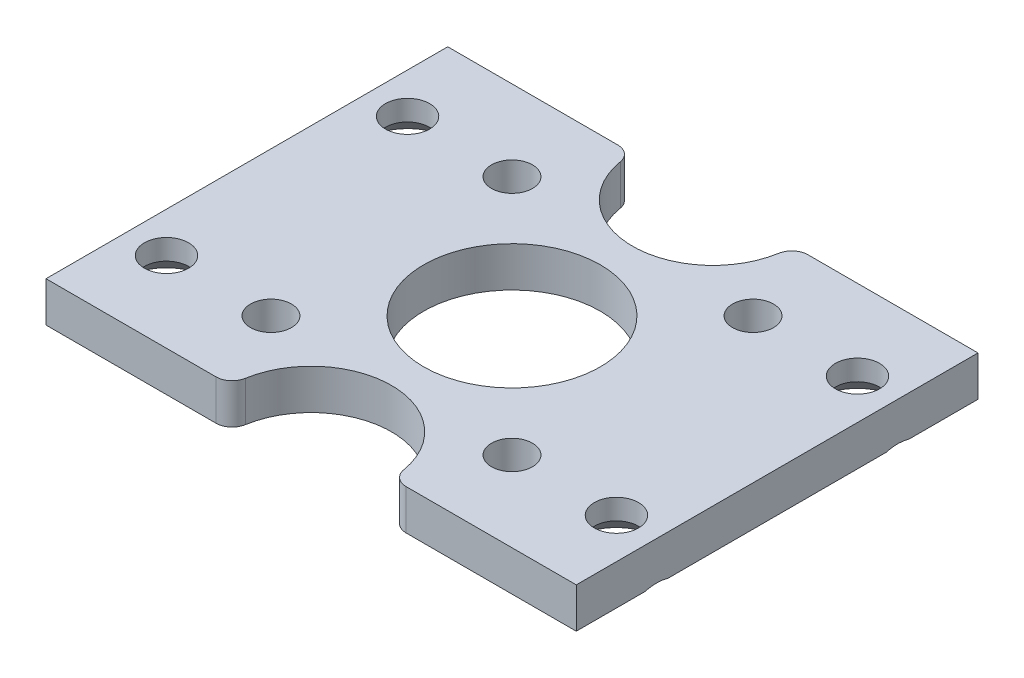
from build123d import *

# Parameters (mm, degrees)
SKETCH_1_W                  = 66
SKETCH_1_H                  = 50
EXTRUDE_1_DEPTH             = 5
HOLE_WIZARD_20_0_20_1_D     = 20
HOLE_WIZARD_22_0_22_1_D     = 22
HOLE_WIZARD_5_1_5_1_1_D     = 5.1
HOLE_WIZARD_M5_1_AT_2_COUNT = 2
HOLE_WIZARD_M5_1_AT_2_PITCH = 30
HOLE_WIZARD_M5_1_AT_3_COUNT = 2
HOLE_WIZARD_M5_1_AT_3_PITCH = 63.529520697
HOLE_WIZARD_M5_1_AT_4_COUNT = 2
HOLE_WIZARD_M5_1_AT_4_PITCH = 56
FILLET_1_R                  = 2


with BuildPart() as part:
    # 草图1 → 凸台-拉伸1 (new body)
    with BuildSketch(Plane.XZ):
        with Locations((33, -25)):
            Rectangle(SKETCH_1_W, SKETCH_1_H)
    extrude(amount=-EXTRUDE_1_DEPTH)

    # Ø20.0 (20) 直径孔1 (through all)
    with Locations(Plane(origin=(0, 5, 0), x_dir=(1, 0, 0), z_dir=(0, 1, 0))):
        with Locations((33, 0), (33, 50)):
            Hole(HOLE_WIZARD_20_0_20_1_D / 2)

    # Ø22.0 (22) 直径孔1 (through all)
    with Locations(Plane(origin=(0, 0, 0), x_dir=(-1, 0, 0), z_dir=(0, -1, 0))):
        with Locations((-33, 25)):
            Hole(HOLE_WIZARD_22_0_22_1_D / 2)

    # Ø5.1 (5.1) 直径孔1 (through all)
    with Locations(Plane(origin=(0, 0, 0), x_dir=(-1, 0, 0), z_dir=(0, -1, 0))):
        with Locations((-18, 10), (-48, 40), (-48, 10), (-18, 40)):
            Hole(HOLE_WIZARD_5_1_5_1_1_D / 2)

    # 草图8 → M5 平头机械螺钉的锥形沉头孔1 (revolve, cut)
    with BuildSketch(Plane(origin=(5, 0, -40), x_dir=(0, 0, -1), z_dir=(1, 0, 0))):
        Polygon((0, 0), (0, 5), (2.75, 5), (2.75, 2.45), (5.2, 0), align=None)
    hole_wizard_m5_1 = revolve(axis=Axis((5, -6.35, -40), (0, 1, 0)), mode=Mode.SUBTRACT)

    # M5 平头机械螺钉的锥形沉头孔1 at 2: M5 平头机械螺钉的锥形沉头孔1 ×2
    with Locations(*[(0, 0, i * HOLE_WIZARD_M5_1_AT_2_PITCH) for i in range(1, HOLE_WIZARD_M5_1_AT_2_COUNT)]):
        add(hole_wizard_m5_1, mode=Mode.SUBTRACT)

    # M5 平头机械螺钉的锥形沉头孔1 at 3: M5 平头机械螺钉的锥形沉头孔1 ×2
    with Locations(*[Vector(0.8814799700287818, 0, 0.47222141251541966) * (i * HOLE_WIZARD_M5_1_AT_3_PITCH) for i in range(1, HOLE_WIZARD_M5_1_AT_3_COUNT)]):
        add(hole_wizard_m5_1, mode=Mode.SUBTRACT)

    # M5 平头机械螺钉的锥形沉头孔1 at 4: M5 平头机械螺钉的锥形沉头孔1 ×2
    with Locations(*[(i * HOLE_WIZARD_M5_1_AT_4_PITCH, 0, 0) for i in range(1, HOLE_WIZARD_M5_1_AT_4_COUNT)]):
        add(hole_wizard_m5_1, mode=Mode.SUBTRACT)

    # 圆角1
    fillet_1_edges = [part.edges().sort_by_distance(p)[0] for p in [
        (23, 2.5, -50),
        (43, 2.5, -50),
        (43, 2.5, 0),
        (23, 2.5, 0),
    ]]
    fillet(fillet_1_edges, radius=FILLET_1_R)


solid = part.part
